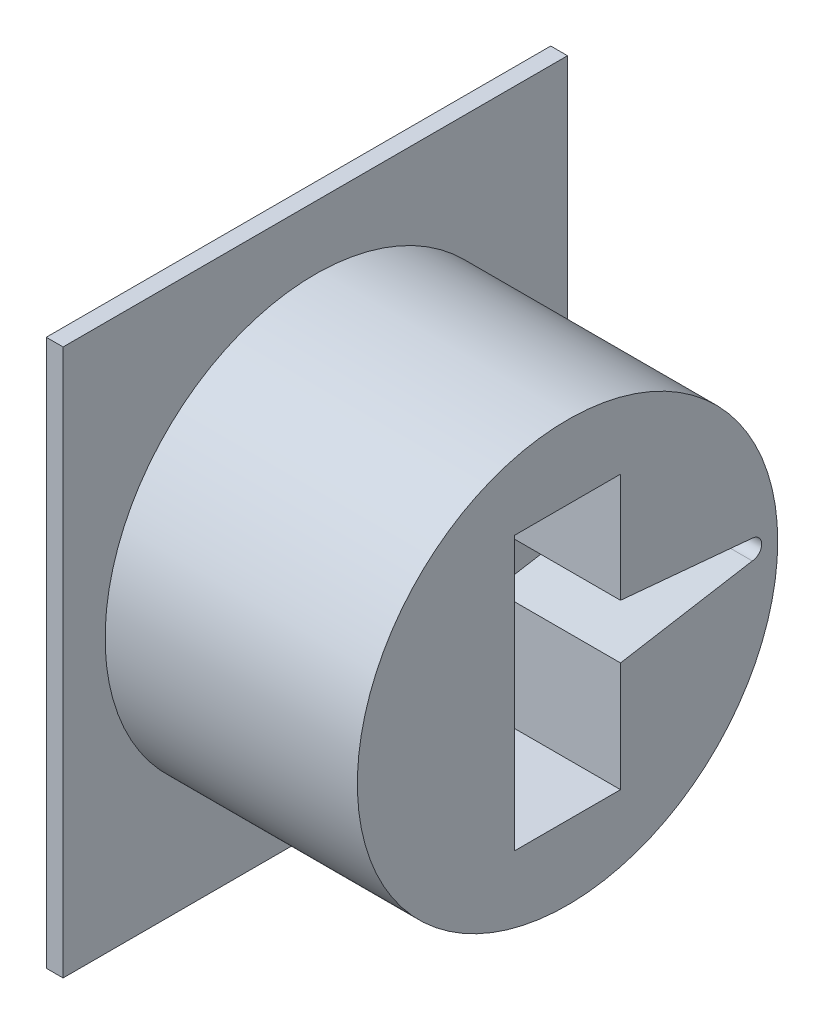
from build123d import *

# Parameters (mm, degrees)
SKETCH3_R           = 25
BOSS_EXTRUDE2_DEPTH = 30
CUT_EXTRUDE1_DEPTH  = 15
SKETCH6_W           = 60
SKETCH6_H           = 65
BOSS_EXTRUDE3_DEPTH = 2


with BuildPart() as part:
    # Sketch3 → Boss-Extrude2 (new body)
    with BuildSketch(Plane(origin=(0, 0, 0), x_dir=(0, 0, -1), z_dir=(1, 0, 0))):
        Circle(SKETCH3_R)
    extrude(amount=BOSS_EXTRUDE2_DEPTH)

    # Sketch4 → Cut-Extrude1 (cut)
    with BuildSketch(Plane(origin=(30, 0, 0), x_dir=(0, 0, -1), z_dir=(1, 0, 0))):
        with BuildLine():
            Line((6.3, 3.252817327), (22.023267424, 1.812565295))
            ThreePointArc((22.023267424, 1.812565295), (23.090240495, 0.619111869), (21.975368687, -0.529723832))
            Line((21.975368687, -0.529723832), (6.3, -3.196442617))
            Line((6.3, -3.196442617), (6.3, -16.25))
            Line((6.3, -16.25), (-6.3, -16.25))
            Line((-6.3, -16.25), (-6.3, 16.25))
            Line((-6.3, 16.25), (6.3, 16.25))
            Line((6.3, 16.25), (6.3, 3.252817327))
        make_face()
    extrude(amount=-CUT_EXTRUDE1_DEPTH, mode=Mode.SUBTRACT)

    # Sketch6 → Boss-Extrude3 (add)
    with BuildSketch(Plane.ZY):
        Rectangle(SKETCH6_W, SKETCH6_H)
    extrude(amount=BOSS_EXTRUDE3_DEPTH)


solid = part.part
